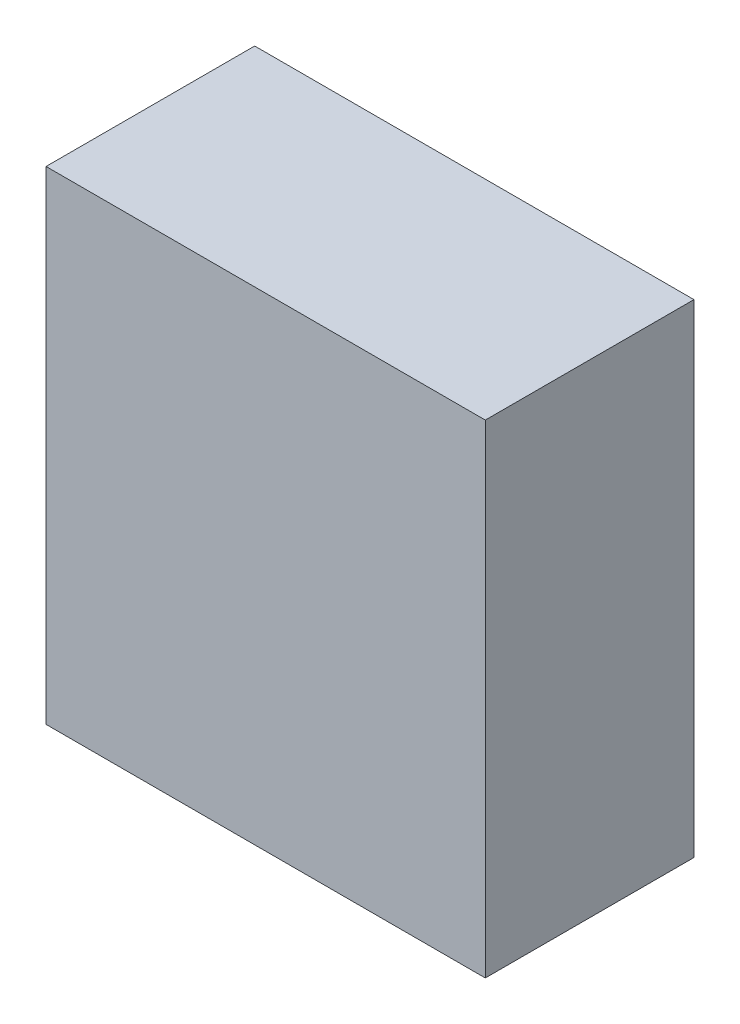
from build123d import *

# Parameters (mm, degrees)
SKETCH_1_W      = 800
SKETCH_1_H      = 880
EXTRUDE_1_DEPTH = 380


with BuildPart() as part:
    # Эскиз1 → Бобышка-Вытянуть1 (new body)
    with BuildSketch(Plane.XY):
        Rectangle(SKETCH_1_W, SKETCH_1_H)
    extrude(amount=EXTRUDE_1_DEPTH)


solid = part.part
